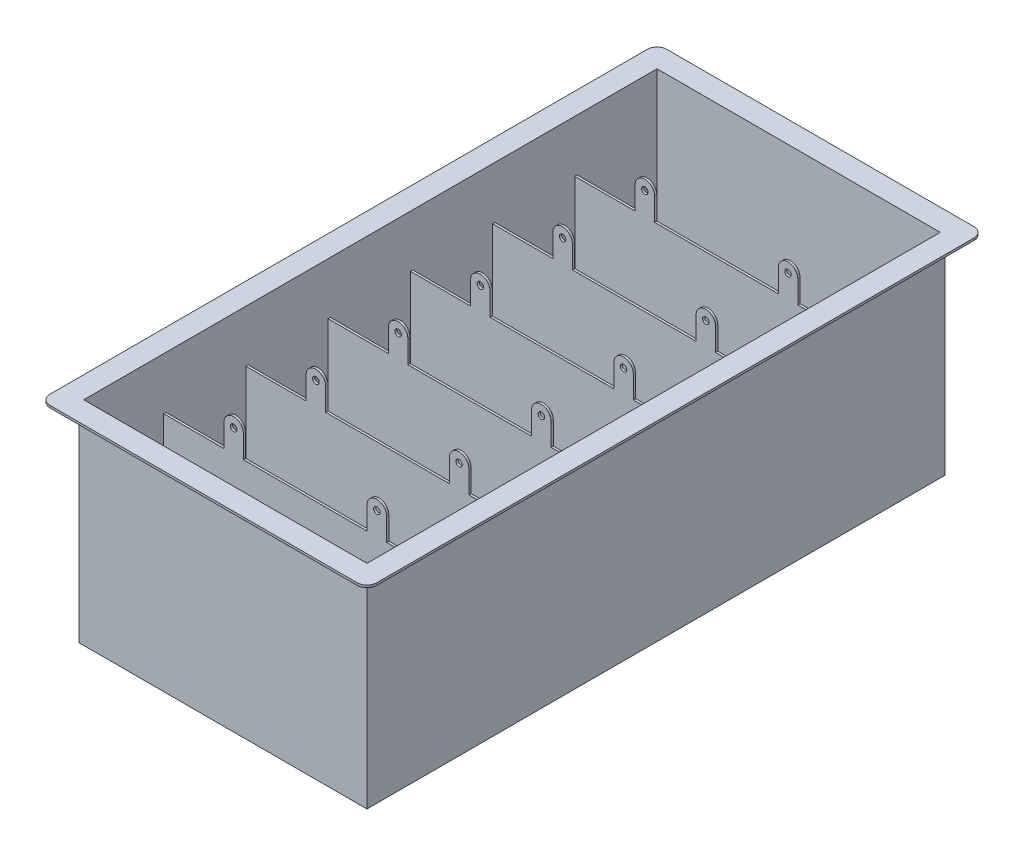
from build123d import *

# Parameters (mm, degrees)
SKETCH1_W           = 281.317999974
SKETCH1_H           = 564.917999956
BOSS_EXTRUDE1_DEPTH = 2.640000816
SKETCH2_W           = 281.317999974
SKETCH2_H           = 564.917999956
SKETCH2_W_2         = 276.918000138
SKETCH2_H_2         = 560.51800012
BOSS_EXTRUDE2_DEPTH = 203.2
SKETCH3_W           = 319.417999974
SKETCH3_H           = 603.017999956
SKETCH3_W_2         = 281.317999974
SKETCH3_H_2         = 564.917999956
BOSS_EXTRUDE3_DEPTH = 2.2
SKETCH5_W           = 276.918000138
SKETCH5_H           = 2.199999918
BOSS_EXTRUDE5_DEPTH = 152.4
SKETCH7_R           = 3.175
BOSS_EXTRUDE6_DEPTH = 2.2
LPATTERN1_COUNT     = 6
LPATTERN1_PITCH     = 80.399999982
FILLET4_R           = 9.525


with BuildPart() as part:
    # Sketch1 → Boss-Extrude1 (new body)
    with BuildSketch(Plane(origin=(0, 0, 0), x_dir=(1, 0, 0), z_dir=(0, 1, 0))):
        Rectangle(SKETCH1_W, SKETCH1_H)
    extrude(amount=BOSS_EXTRUDE1_DEPTH)

    # Sketch2 → Boss-Extrude2 (add)
    with BuildSketch(Plane(origin=(0, 2.640000816, 0), x_dir=(1, 0, 0), z_dir=(0, 1, 0))):
        Rectangle(SKETCH2_W, SKETCH2_H)
        Rectangle(SKETCH2_W_2, SKETCH2_H_2, mode=Mode.SUBTRACT)
    extrude(amount=BOSS_EXTRUDE2_DEPTH)

    # Sketch3 → Boss-Extrude3 (add)
    with BuildSketch(Plane(origin=(0, 205.840000816, 0), x_dir=(1, 0, 0), z_dir=(0, 1, 0))):
        Rectangle(SKETCH3_W, SKETCH3_H)
        Rectangle(SKETCH3_W_2, SKETCH3_H_2, mode=Mode.SUBTRACT)
    extrude(amount=-BOSS_EXTRUDE3_DEPTH)

    # Sketch5 → Boss-Extrude5 (add)
    with BuildSketch(Plane(origin=(0, 2.640000816, 0), x_dir=(1, 0, 0), z_dir=(0, 1, 0))):
        with Locations((0, 200.959000037)):
            Rectangle(SKETCH5_W, SKETCH5_H)
    boss_extrude5 = extrude(amount=BOSS_EXTRUDE5_DEPTH)

    # Sketch7 → Boss-Extrude6 (add)
    # profile 1 of 2: a face of its own
    with BuildSketch(Plane.XY.offset(-199.859000078)):
        with BuildLine():
            Line((-79.525, 155.040000816), (-60.475, 155.040000816))
            Line((-60.475, 155.040000816), (-60.475, 177.265000816))
            ThreePointArc((-60.475, 177.265000816), (-70, 186.790000816), (-79.525, 177.265000816))
            Line((-79.525, 177.265000816), (-79.525, 155.040000816))
        make_face()
        with Locations((-70, 177.265000816)):
            Circle(SKETCH7_R, mode=Mode.SUBTRACT)
    # profile 2 of 2: a face of its own
    with BuildSketch(Plane.XY.offset(-199.859000078)):
        with BuildLine():
            Line((79.525, 155.040000816), (79.525, 177.265000816))
            ThreePointArc((79.525, 177.265000816), (70, 186.790000816), (60.475, 177.265000816))
            Line((60.475, 177.265000816), (60.475, 155.040000816))
            Line((60.475, 155.040000816), (79.525, 155.040000816))
        make_face()
        with Locations((70, 177.265000816)):
            Circle(SKETCH7_R, mode=Mode.SUBTRACT)
    boss_extrude6 = extrude(amount=-BOSS_EXTRUDE6_DEPTH)

    # LPattern1: Boss-Extrude5, Boss-Extrude6 ×6
    with Locations(*[(0, 0, i * LPATTERN1_PITCH) for i in range(1, LPATTERN1_COUNT)]):
        add(boss_extrude5)
        add(boss_extrude6)

    # Fillet4
    fillet4_edges = [part.edges().sort_by_distance(p)[0] for p in [
        (-159.708999987, 204.740000816, 301.508999978),
        (-159.708999987, 204.740000816, -301.508999978),
        (159.708999987, 204.740000816, -301.508999978),
        (159.708999987, 204.740000816, 301.508999978),
    ]]
    fillet(fillet4_edges, radius=FILLET4_R)


solid = part.part
